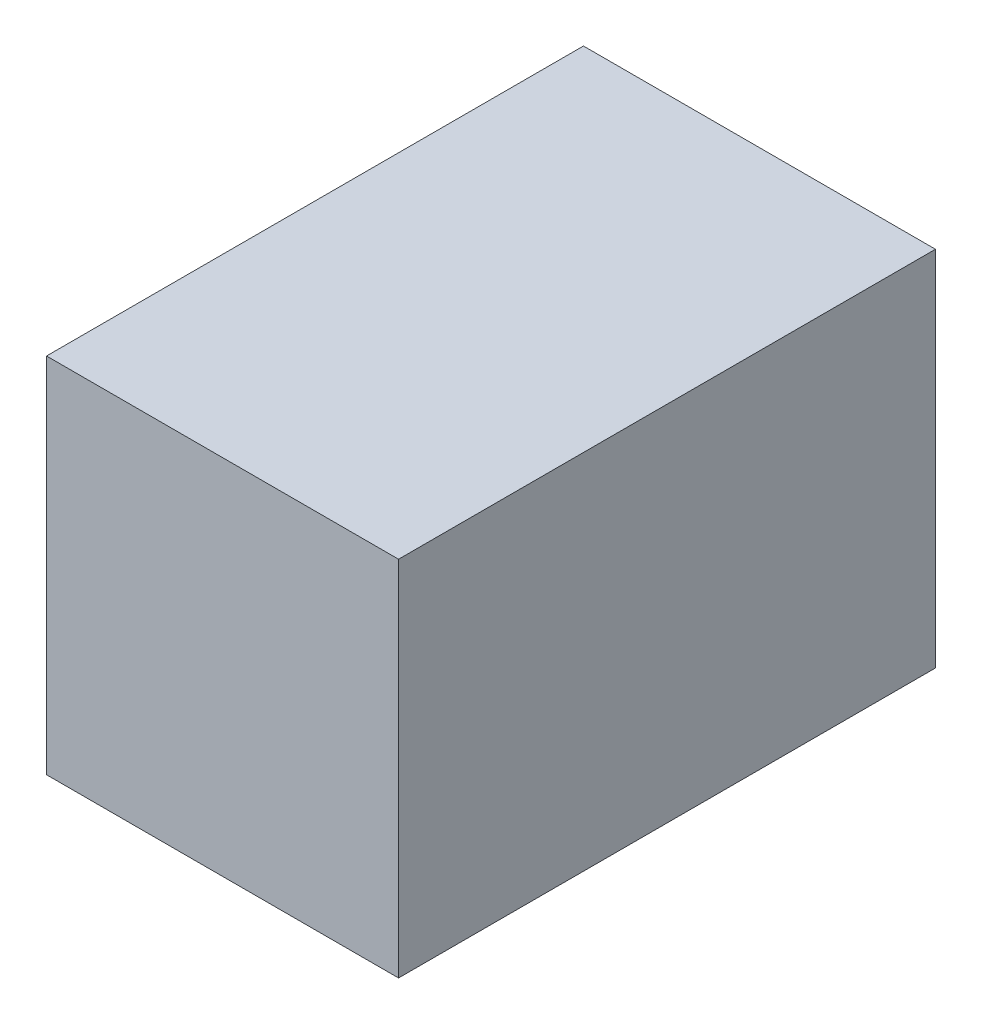
from build123d import *

# Parameters (mm, degrees)
SKETCH1_W           = 99
SKETCH1_H           = 102
BOSS_EXTRUDE1_DEPTH = 151


with BuildPart() as part:
    # Sketch1 → Boss-Extrude1 (new body)
    with BuildSketch(Plane.XY):
        with Locations((-49.5, -51)):
            Rectangle(SKETCH1_W, SKETCH1_H)
    extrude(amount=BOSS_EXTRUDE1_DEPTH)


solid = part.part
